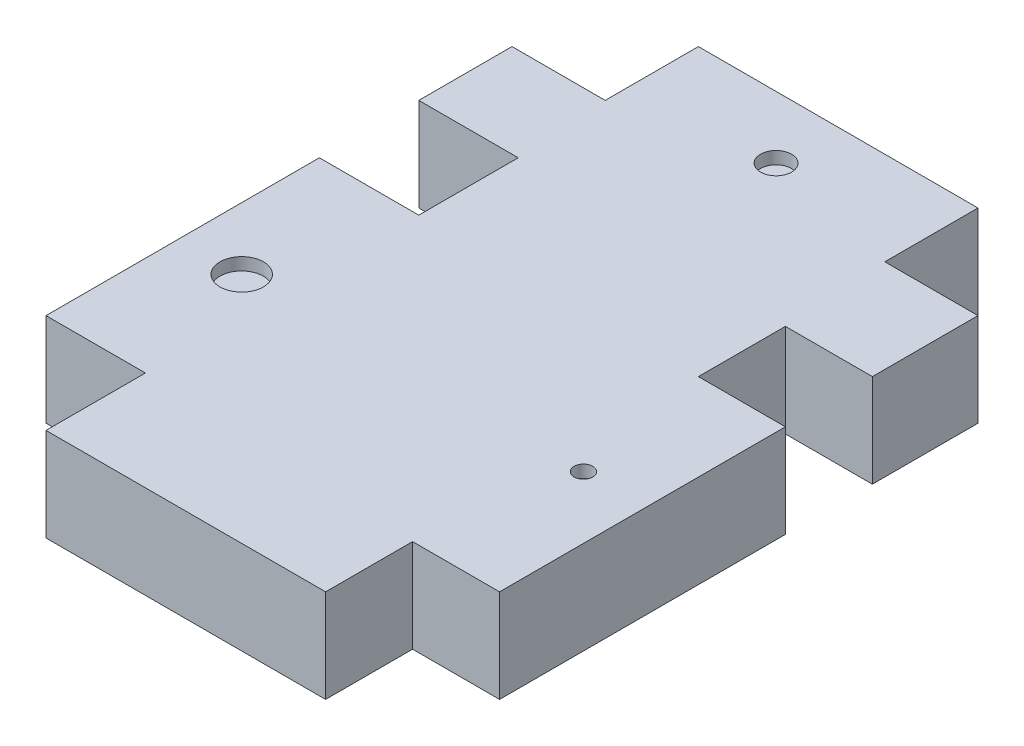
from build123d import *

# Parameters (mm, degrees)
BOSS_EXTRUDE1_DEPTH = 19.05
SKETCH2_R           = 1.905
SKETCH2_R_2         = 4.445
SKETCH2_R_3         = 3.175
CUT_EXTRUDE1_DEPTH  = 2.54


with BuildPart() as part:
    # Sketch1 → Boss-Extrude1 (new body)
    with BuildSketch(Plane(origin=(0, 0, 0), x_dir=(1, 0, 0), z_dir=(0, 1, 0))):
        Polygon((-9.525, 48.26), (-9.525, 67.31), (-66.675, 67.31), (-66.675, 48.26), (-85.725, 48.26), (-85.725, 29.21), (-65.405, 29.21), (-65.405, 8.89), (-85.725, 8.89), (-85.725, -46.99), (-65.405, -46.99), (-65.405, -67.31), (-8.255, -67.31), (-8.255, -49.53), (9.525, -49.53), (9.525, 8.89), (-8.255, 8.89), (-8.255, 26.67), (9.525, 26.67), (9.525, 48.26), align=None)
    extrude(amount=BOSS_EXTRUDE1_DEPTH)

    # Sketch2 → Cut-Extrude1 (cut)
    with BuildSketch(Plane(origin=(0, 19.05, 0), x_dir=(1, 0, 0), z_dir=(0, 1, 0))):
        with Locations(Location((-3.175, -19.685, 0), (0, 0, 270))):
            Circle(SKETCH2_R)
        with Locations(Location((-73.025, -19.685, 0), (0, 0, 270))):
            Circle(SKETCH2_R_2)
        with Locations(Location((-38.1, 54.61, 0), (0, 0, 270))):
            Circle(SKETCH2_R_3)
    extrude(amount=-CUT_EXTRUDE1_DEPTH, mode=Mode.SUBTRACT)


solid = part.part
